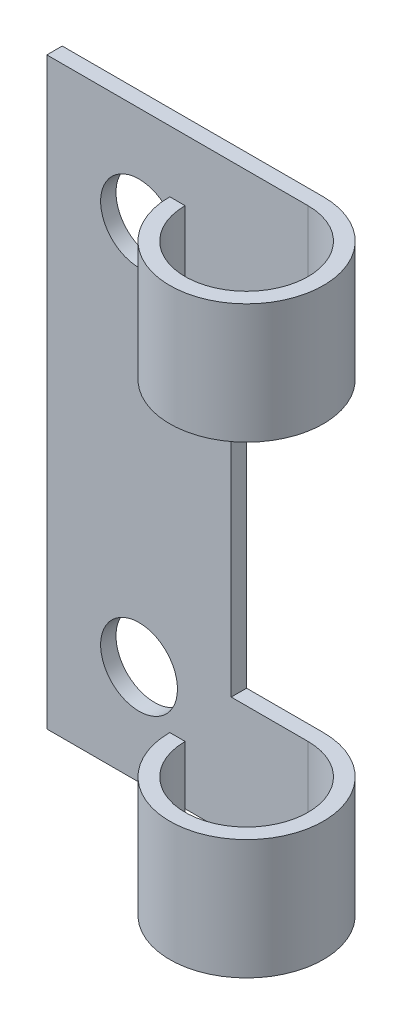
from build123d import *

# Parameters (mm, degrees)
SKETCH_1_W      = 12
SKETCH_1_H      = 38
SKETCH_1_R      = 2.5
EXTRUDE_1_DEPTH = 1
EXTRUDE_2_DEPTH = 7.8
EXTRUDE_START   = -30.2
EXTRUDE_3_DEPTH = 7.8


with BuildPart() as part:
    # 草图1 → 凸台-拉伸1 (new body)
    with BuildSketch(Plane.XY):
        with Locations((6, 19)):
            Rectangle(SKETCH_1_W, SKETCH_1_H)
        with Locations((6, 31.5)):
            Circle(SKETCH_1_R, mode=Mode.SUBTRACT)
        with Locations((6, 6.5)):
            Circle(SKETCH_1_R, mode=Mode.SUBTRACT)
    extrude(amount=EXTRUDE_1_DEPTH)

    # 草图2 → 凸台-拉伸2 (add)
    with BuildSketch(Plane(origin=(0, 38, 0), x_dir=(1, 0, 0), z_dir=(0, 1, 0))):
        with BuildLine():
            Line((12, 0), (17, 0))
            ThreePointArc((17, 0), (20.535533906, -8.535533906), (12, -5))
            Line((12, -5), (13, -5))
            ThreePointArc((13, -5), (19.828427125, -7.828427125), (17, -1))
            Line((17, -1), (12, -1))
            Line((12, -1), (12, 0))
        make_face()
    extrude(amount=-EXTRUDE_2_DEPTH)

    # 草图2<2> → 凸台-拉伸3 (add)
    with BuildSketch(Plane(origin=(0, 38, 0), x_dir=(1, 0, 0), z_dir=(0, 1, 0)).offset(EXTRUDE_START)):
        with BuildLine():
            Line((12, 0), (17, 0))
            ThreePointArc((17, 0), (20.535533906, -8.535533906), (12, -5))
            Line((12, -5), (13, -5))
            ThreePointArc((13, -5), (19.828427125, -7.828427125), (17, -1))
            Line((17, -1), (12, -1))
            Line((12, -1), (12, 0))
        make_face()
    extrude(amount=-EXTRUDE_3_DEPTH)


solid = part.part
